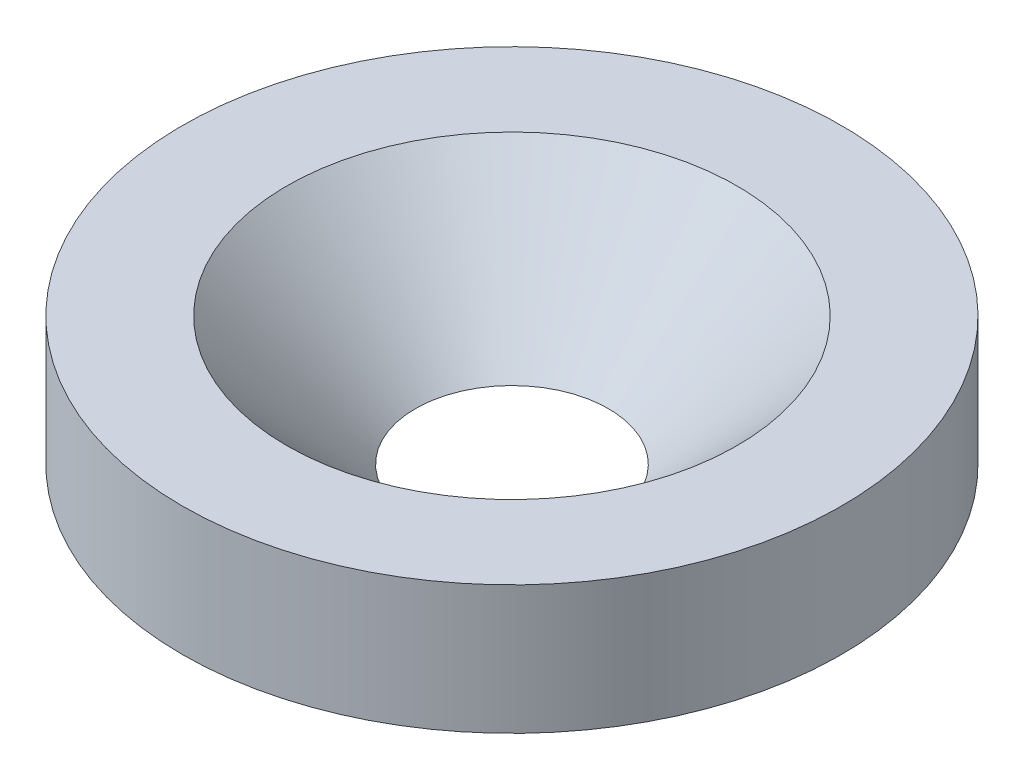
from build123d import *


with BuildPart() as part:
    # Sketch1 → Revolve1 (revolve)
    with BuildSketch(Plane.XY, mode=Mode.PRIVATE) as revolve1_sk:
        Polygon((14, 8), (20.5, 8), (20.5, 0), (6, 0), align=None)
    revolve(revolve1_sk.sketch.rotate(Axis((0, 18.341019417, 0), (0, -1, 0)), 90), axis=Axis((0, 18.341019417, 0), (0, -1, 0)))


solid = part.part
